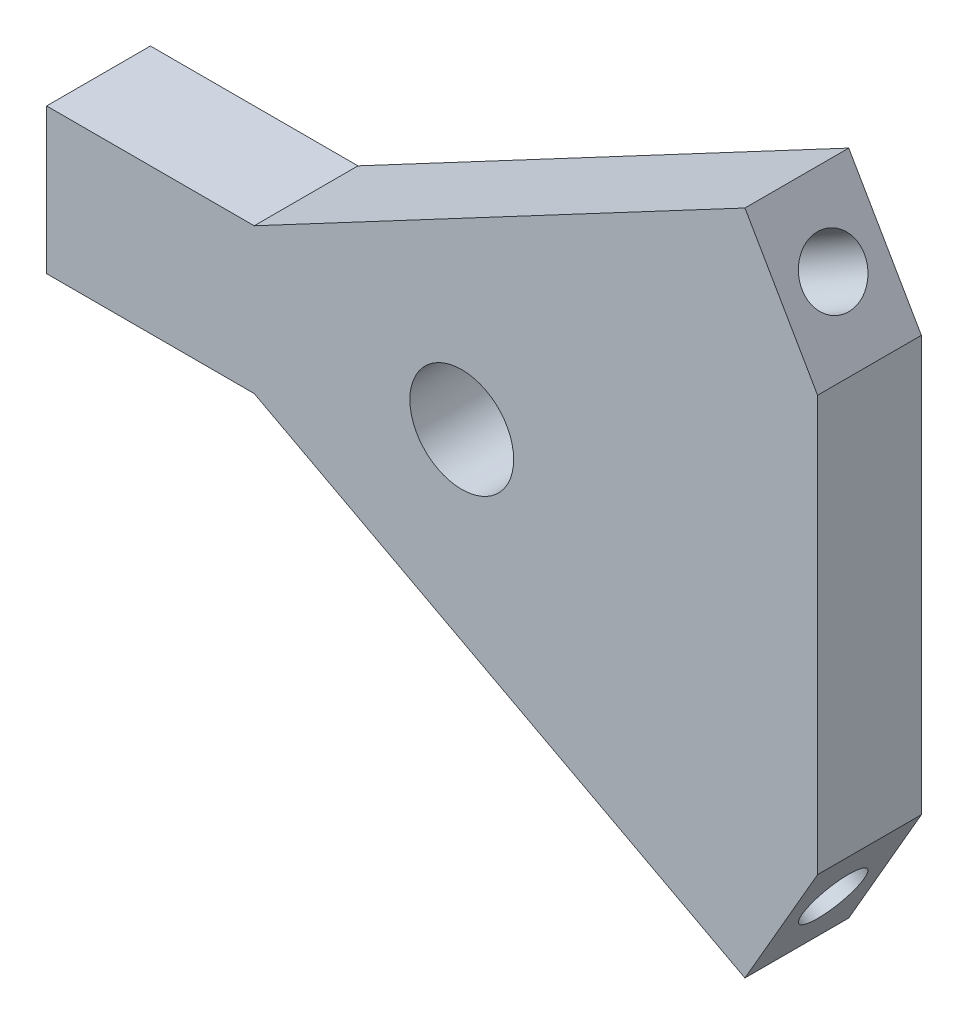
from build123d import *

# Parameters (mm, degrees)
BOSS_EXTRU_2_DEPTH      = 10
ESQUISSE4_R             = 3
ENL_V_MAT_EXTRU_3_DEPTH = 20
ESQUISSE6_R             = 3
ENL_V_MAT_EXTRU_4_DEPTH = 20
ESQUISSE7_R             = 3
ENL_V_MAT_EXTRU_5_DEPTH = 20
ESQUISSE8_R             = 5
ENL_V_MAT_EXTRU_6_DEPTH = 20


with BuildPart() as part:
    # Esquisse1 → Boss.-Extru.2 (new body)
    with BuildSketch(Plane.XY):
        Polygon((-20, -7), (-20, 7), (0, 7), (47.282032303, 32.124355653), (54.282032303, 20), (54.282032303, -20), (47.282032303, -32.124355653), (0, -7), align=None)
    extrude(amount=BOSS_EXTRU_2_DEPTH)

    # Esquisse4 → Enlèv. mat.-Extru.3 (cut)
    with BuildSketch(Plane.ZY.offset(20)):
        with Locations((5, 0)):
            Circle(ESQUISSE4_R)
    extrude(amount=-ENL_V_MAT_EXTRU_3_DEPTH, mode=Mode.SUBTRACT)

    # Esquisse6 → Enlèv. mat.-Extru.4 (cut)
    with BuildSketch(Plane(origin=(49.371778265, 28.504809472, 0), x_dir=(0.4999999999999953, -0.8660254037844415, 0), z_dir=(0.8660254037844415, 0.4999999999999953, 0))):
        with Locations(Location((2.820508076, -5, 0), (0, 0, 180))):
            Circle(ESQUISSE6_R)
    extrude(amount=-ENL_V_MAT_EXTRU_4_DEPTH, mode=Mode.SUBTRACT)

    # Esquisse7 → Enlèv. mat.-Extru.5 (cut)
    with BuildSketch(Plane(origin=(49.371778265, -28.504809472, 0), x_dir=(-0.5000000000000256, -0.8660254037844237, 0), z_dir=(0.8660254037844238, -0.5000000000000258, 0))):
        with Locations(Location((-2.820508076, -5, 0), (0, 0, 180))):
            Circle(ESQUISSE7_R)
    extrude(amount=-ENL_V_MAT_EXTRU_5_DEPTH, mode=Mode.SUBTRACT)

    # Esquisse8 → Enlèv. mat.-Extru.6 (cut)
    with BuildSketch(Plane(origin=(0, 0, 0), x_dir=(-1, 0, 0), z_dir=(0, 0, -1))):
        with Locations((-20, 0)):
            Circle(ESQUISSE8_R)
    extrude(amount=-ENL_V_MAT_EXTRU_6_DEPTH, mode=Mode.SUBTRACT)


solid = part.part
